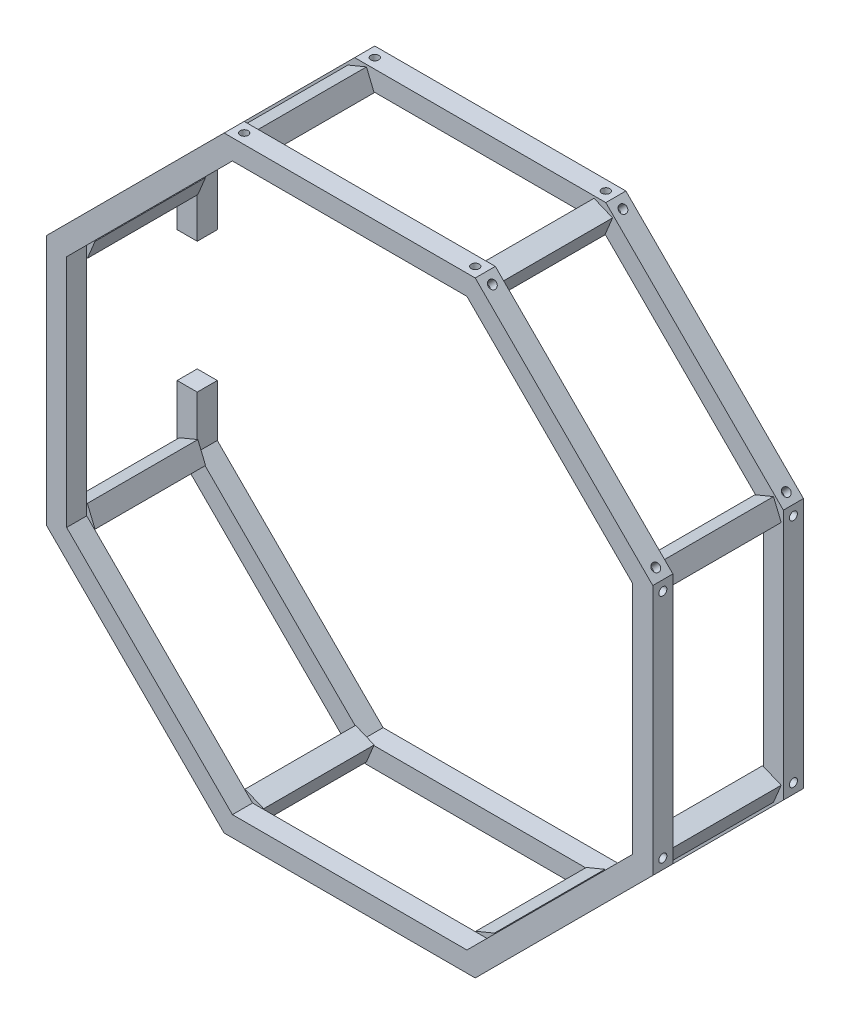
from build123d import *

# Parameters (mm, degrees)
BOSS_EXTRUDE1_DEPTH   = 20
BOSS_EXTRUDE3_DEPTH   = 110
BOSS_EXTRUDE3_2_DEPTH = 110
BOSS_EXTRUDE3_3_DEPTH = 110
BOSS_EXTRUDE3_4_DEPTH = 110
BOSS_EXTRUDE3_5_DEPTH = 110
BOSS_EXTRUDE3_6_DEPTH = 110
BOSS_EXTRUDE3_7_DEPTH = 110
BOSS_EXTRUDE3_8_DEPTH = 110
BOSS_EXTRUDE4_DEPTH   = 20
SKETCH19_R            = 4
CUT_EXTRUDE1_DEPTH    = 10
SKETCH29_R            = 4
CUT_EXTRUDE2_DEPTH    = 10
SKETCH30_R            = 4
CUT_EXTRUDE3_DEPTH    = 10
SKETCH31_R            = 4
CUT_EXTRUDE4_DEPTH    = 10
CUT_EXTRUDE5_START    = -10
SKETCH32_R            = 4
CUT_EXTRUDE5_DEPTH    = 10
CUT_EXTRUDE6_START    = -10
SKETCH33_R            = 4
CUT_EXTRUDE6_DEPTH    = 10
CUT_EXTRUDE7_START    = -10
SKETCH34_R            = 4
CUT_EXTRUDE7_DEPTH    = 10
CUT_EXTRUDE8_START    = -10
SKETCH35_R            = 4
CUT_EXTRUDE8_DEPTH    = 10
SKETCH37_W            = 20
SKETCH37_H            = 130.001822869
CUT_EXTRUDE11_DEPTH   = 20


with BuildPart() as part:
    # Sketch1 → Boss-Extrude1 (new body)
    with BuildSketch(Plane.XY):
        Polygon((301.776695297, 125), (125, 301.776695297), (-125, 301.776695297), (-301.776695297, 125), (-301.776695297, -125), (-125, -301.776695297), (125, -301.776695297), (301.776695297, -125), align=None)
        Polygon((-281.776695297, 116.715728753), (-281.776695297, -116.715728753), (-116.715728753, -281.776695297), (116.715728753, -281.776695297), (281.776695297, -116.715728753), (281.776695297, 116.715728753), (116.715728753, 281.776695297), (-116.715728753, 281.776695297), align=None, mode=Mode.SUBTRACT)
    extrude(amount=BOSS_EXTRUDE1_DEPTH)


with BuildPart() as body_2:
    # Sketch17 → Boss-Extrude3 (new body)
    with BuildSketch(Plane.XY.offset(20)):
        Polygon((-124.104887748, 273.484443861), (-105.627297098, 281.138112508), (-113.280965745, 299.615703158), (-131.758556395, 291.962034511), align=None)
    extrude(amount=BOSS_EXTRUDE3_DEPTH)


with BuildPart() as body_3:
    # Sketch17 → Boss-Extrude3 2 (new body)
    with BuildSketch(Plane.XY.offset(20)):
        Polygon((105.627297098, 281.138112508), (124.104887748, 273.484443861), (131.758556395, 291.962034511), (113.280965745, 299.615703158), align=None)
    extrude(amount=BOSS_EXTRUDE3_2_DEPTH)


with BuildPart() as body_4:
    # Sketch17 → Boss-Extrude3 3 (new body)
    with BuildSketch(Plane.XY.offset(20)):
        Polygon((273.484443861, 124.104887748), (281.138112508, 105.627297098), (299.615703158, 113.280965745), (291.962034511, 131.758556395), align=None)
    extrude(amount=BOSS_EXTRUDE3_3_DEPTH)


with BuildPart() as body_5:
    # Sketch17 → Boss-Extrude3 4 (new body)
    with BuildSketch(Plane.XY.offset(20)):
        Polygon((281.138112508, -105.627297098), (273.484443861, -124.104887748), (291.962034511, -131.758556395), (299.615703158, -113.280965745), align=None)
    extrude(amount=BOSS_EXTRUDE3_4_DEPTH)


with BuildPart() as body_6:
    # Sketch17 → Boss-Extrude3 5 (new body)
    with BuildSketch(Plane.XY.offset(20)):
        Polygon((124.104887748, -273.484443861), (105.627297098, -281.138112508), (113.280965745, -299.615703158), (131.758556395, -291.962034511), align=None)
    extrude(amount=BOSS_EXTRUDE3_5_DEPTH)


with BuildPart() as body_7:
    # Sketch17 → Boss-Extrude3 6 (new body)
    with BuildSketch(Plane.XY.offset(20)):
        Polygon((-105.627297098, -281.138112508), (-124.104887748, -273.484443861), (-131.758556395, -291.962034511), (-113.280965745, -299.615703158), align=None)
    extrude(amount=BOSS_EXTRUDE3_6_DEPTH)


with BuildPart() as body_8:
    # Sketch17 → Boss-Extrude3 7 (new body)
    with BuildSketch(Plane.XY.offset(20)):
        Polygon((-273.484443861, -124.104887748), (-281.138112508, -105.627297098), (-299.615703158, -113.280965745), (-291.962034511, -131.758556395), align=None)
    extrude(amount=BOSS_EXTRUDE3_7_DEPTH)


with BuildPart() as body_9:
    # Sketch17 → Boss-Extrude3 8 (new body)
    with BuildSketch(Plane.XY.offset(20)):
        Polygon((-281.138112508, 105.627297098), (-273.484443861, 124.104887748), (-291.962034511, 131.758556395), (-299.615703158, 113.280965745), align=None)
    extrude(amount=BOSS_EXTRUDE3_8_DEPTH)


with BuildPart() as body_10:
    # Sketch18 → Boss-Extrude4 (new body)
    with BuildSketch(Plane.XY.offset(130)):
        Polygon((-301.776695297, 125), (-301.776695297, -125), (-125, -301.776695297), (125, -301.776695297), (301.776695297, -125), (301.776695297, 125), (125, 301.776695297), (-125, 301.776695297), align=None)
        Polygon((-281.776695297, 116.715728753), (-281.776695297, -116.715728753), (-116.715728753, -281.776695297), (116.715728753, -281.776695297), (281.776695297, -116.715728753), (281.776695297, 116.715728753), (116.715728753, 281.776695297), (-116.715728753, 281.776695297), align=None, mode=Mode.SUBTRACT)
    extrude(amount=BOSS_EXTRUDE4_DEPTH)


with BuildPart() as cut_extrude1_tool:
    # Sketch19 → Cut-Extrude1 (new body)
    with BuildSketch(Plane.XZ.offset(301.776695297)):
        with Locations((-115, 140)):
            Circle(SKETCH19_R)
        with Locations((-115, 10)):
            Circle(SKETCH19_R)
        with Locations(Location((115, 140, 0), (0, 0, 180))):
            Circle(SKETCH19_R)
        with Locations(Location((115, 10, 0), (0, 0, 180))):
            Circle(SKETCH19_R)
    extrude(amount=-CUT_EXTRUDE1_DEPTH)


with BuildPart() as part_1:
    add(part.part)

    # Cut-Extrude1: cut by cut_extrude1_tool
    add(cut_extrude1_tool.part, mode=Mode.SUBTRACT)


with BuildPart() as body_10_1:
    add(body_10.part)

    # Cut-Extrude1: cut by cut_extrude1_tool
    add(cut_extrude1_tool.part, mode=Mode.SUBTRACT)


with BuildPart() as cut_extrude2_tool:
    # Sketch29 → Cut-Extrude2 (new body)
    with BuildSketch(Plane(origin=(213.388347648, -213.388347648, 0), x_dir=(0, 0, -1), z_dir=(0.7071067811865477, -0.7071067811865474, 0))):
        with Locations(Location((-140, 115, 0), (0, 0, 90))):
            Circle(SKETCH29_R)
        with Locations(Location((-10, 115, 0), (0, 0, 90))):
            Circle(SKETCH29_R)
        with Locations(Location((-10, -115, 0), (0, 0, 270))):
            Circle(SKETCH29_R)
        with Locations(Location((-140, -115, 0), (0, 0, 270))):
            Circle(SKETCH29_R)
    extrude(amount=-CUT_EXTRUDE2_DEPTH)


with BuildPart() as part_2:
    add(part_1.part)

    # Cut-Extrude2: cut by cut_extrude2_tool
    add(cut_extrude2_tool.part, mode=Mode.SUBTRACT)


with BuildPart() as body_10_2:
    add(body_10_1.part)

    # Cut-Extrude2: cut by cut_extrude2_tool
    add(cut_extrude2_tool.part, mode=Mode.SUBTRACT)


with BuildPart() as cut_extrude3_tool:
    # Sketch30 → Cut-Extrude3 (new body)
    with BuildSketch(Plane(origin=(301.776695297, 0, 0), x_dir=(0, 0, -1), z_dir=(1, 0, 0))):
        with Locations(Location((-140, 115, 0), (0, 0, 90))):
            Circle(SKETCH30_R)
        with Locations(Location((-10, 115, 0), (0, 0, 90))):
            Circle(SKETCH30_R)
        with Locations(Location((-10, -115, 0), (0, 0, 270))):
            Circle(SKETCH30_R)
        with Locations(Location((-140, -115, 0), (0, 0, 270))):
            Circle(SKETCH30_R)
    extrude(amount=-CUT_EXTRUDE3_DEPTH)


with BuildPart() as part_3:
    add(part_2.part)

    # Cut-Extrude3: cut by cut_extrude3_tool
    add(cut_extrude3_tool.part, mode=Mode.SUBTRACT)


with BuildPart() as body_10_3:
    add(body_10_2.part)

    # Cut-Extrude3: cut by cut_extrude3_tool
    add(cut_extrude3_tool.part, mode=Mode.SUBTRACT)


with BuildPart() as cut_extrude4_tool:
    # Sketch31 → Cut-Extrude4 (new body)
    with BuildSketch(Plane(origin=(213.388347648, 213.388347648, 0), x_dir=(0, 0, -1), z_dir=(0.7071067811865476, 0.7071067811865476, 0))):
        with Locations(Location((-140, 115, 0), (0, 0, 90))):
            Circle(SKETCH31_R)
        with Locations(Location((-10, 115, 0), (0, 0, 90))):
            Circle(SKETCH31_R)
        with Locations(Location((-10, -115, 0), (0, 0, 270))):
            Circle(SKETCH31_R)
        with Locations(Location((-140, -115, 0), (0, 0, 270))):
            Circle(SKETCH31_R)
    extrude(amount=-CUT_EXTRUDE4_DEPTH)


with BuildPart() as part_4:
    add(part_3.part)

    # Cut-Extrude4: cut by cut_extrude4_tool
    add(cut_extrude4_tool.part, mode=Mode.SUBTRACT)


with BuildPart() as body_10_4:
    add(body_10_3.part)

    # Cut-Extrude4: cut by cut_extrude4_tool
    add(cut_extrude4_tool.part, mode=Mode.SUBTRACT)


with BuildPart() as cut_extrude5_tool:
    # Sketch32 → Cut-Extrude5 (new body)
    with BuildSketch(Plane(origin=(0, 301.776695297, 0), x_dir=(1, 0, 0), z_dir=(0, 1, 0)).offset(CUT_EXTRUDE5_START)):
        with Locations((-115, -10)):
            Circle(SKETCH32_R)
        with Locations((-115, -140)):
            Circle(SKETCH32_R)
        with Locations(Location((115, -140, 0), (0, 0, 180))):
            Circle(SKETCH32_R)
        with Locations(Location((115, -10, 0), (0, 0, 180))):
            Circle(SKETCH32_R)
    extrude(amount=CUT_EXTRUDE5_DEPTH)


with BuildPart() as part_5:
    add(part_4.part)

    # Cut-Extrude5: cut by cut_extrude5_tool
    add(cut_extrude5_tool.part, mode=Mode.SUBTRACT)


with BuildPart() as body_10_5:
    add(body_10_4.part)

    # Cut-Extrude5: cut by cut_extrude5_tool
    add(cut_extrude5_tool.part, mode=Mode.SUBTRACT)


with BuildPart() as cut_extrude6_tool:
    # Sketch33 → Cut-Extrude6 (new body)
    with BuildSketch(Plane(origin=(-213.388347648, 213.388347648, 0), x_dir=(0, 0, 1), z_dir=(-0.7071067811865476, 0.7071067811865475, 0)).offset(CUT_EXTRUDE6_START)):
        with Locations(Location((10, 115, 0), (0, 0, 90))):
            Circle(SKETCH33_R)
        with Locations(Location((140, 115, 0), (0, 0, 90))):
            Circle(SKETCH33_R)
        with Locations(Location((140, -115, 0), (0, 0, 270))):
            Circle(SKETCH33_R)
        with Locations(Location((10, -115, 0), (0, 0, 270))):
            Circle(SKETCH33_R)
    extrude(amount=CUT_EXTRUDE6_DEPTH)


with BuildPart() as part_6:
    add(part_5.part)

    # Cut-Extrude6: cut by cut_extrude6_tool
    add(cut_extrude6_tool.part, mode=Mode.SUBTRACT)


with BuildPart() as body_10_6:
    add(body_10_5.part)

    # Cut-Extrude6: cut by cut_extrude6_tool
    add(cut_extrude6_tool.part, mode=Mode.SUBTRACT)


with BuildPart() as cut_extrude7_tool:
    # Sketch34 → Cut-Extrude7 (new body)
    with BuildSketch(Plane.ZY.offset(301.776695297).offset(CUT_EXTRUDE7_START)):
        with Locations(Location((10, 115, 0), (0, 0, 90))):
            Circle(SKETCH34_R)
        with Locations(Location((140, 115, 0), (0, 0, 90))):
            Circle(SKETCH34_R)
        with Locations(Location((140, -115, 0), (0, 0, 270))):
            Circle(SKETCH34_R)
        with Locations(Location((10, -115, 0), (0, 0, 270))):
            Circle(SKETCH34_R)
    extrude(amount=CUT_EXTRUDE7_DEPTH)


with BuildPart() as part_7:
    add(part_6.part)

    # Cut-Extrude7: cut by cut_extrude7_tool
    add(cut_extrude7_tool.part, mode=Mode.SUBTRACT)


with BuildPart() as body_10_7:
    add(body_10_6.part)

    # Cut-Extrude7: cut by cut_extrude7_tool
    add(cut_extrude7_tool.part, mode=Mode.SUBTRACT)


with BuildPart() as cut_extrude8_tool:
    # Sketch35 → Cut-Extrude8 (new body)
    with BuildSketch(Plane(origin=(-213.388347648, -213.388347648, 0), x_dir=(0, 0, 1), z_dir=(-0.7071067811865476, -0.7071067811865475, 0)).offset(CUT_EXTRUDE8_START)):
        with Locations(Location((10, 115, 0), (0, 0, 90))):
            Circle(SKETCH35_R)
        with Locations(Location((140, 115, 0), (0, 0, 90))):
            Circle(SKETCH35_R)
        with Locations(Location((140, -115, 0), (0, 0, 270))):
            Circle(SKETCH35_R)
        with Locations(Location((10, -115, 0), (0, 0, 270))):
            Circle(SKETCH35_R)
    extrude(amount=CUT_EXTRUDE8_DEPTH)


with BuildPart() as part_8:
    add(part_7.part)

    # Cut-Extrude8: cut by cut_extrude8_tool
    add(cut_extrude8_tool.part, mode=Mode.SUBTRACT)

    # Sketch37 → Cut-Extrude11 (cut)
    with BuildSketch(Plane.ZY.offset(301.776695297)):
        with Locations((10, -0.000911435)):
            Rectangle(SKETCH37_W, SKETCH37_H)
    extrude(amount=-CUT_EXTRUDE11_DEPTH, mode=Mode.SUBTRACT)


with BuildPart() as body_10_8:
    add(body_10_7.part)

    # Cut-Extrude8: cut by cut_extrude8_tool
    add(cut_extrude8_tool.part, mode=Mode.SUBTRACT)


solid = Compound([body_2.part, body_3.part, body_4.part, body_5.part, body_6.part, body_7.part, body_8.part, body_9.part, part_8.part, body_10_8.part])
